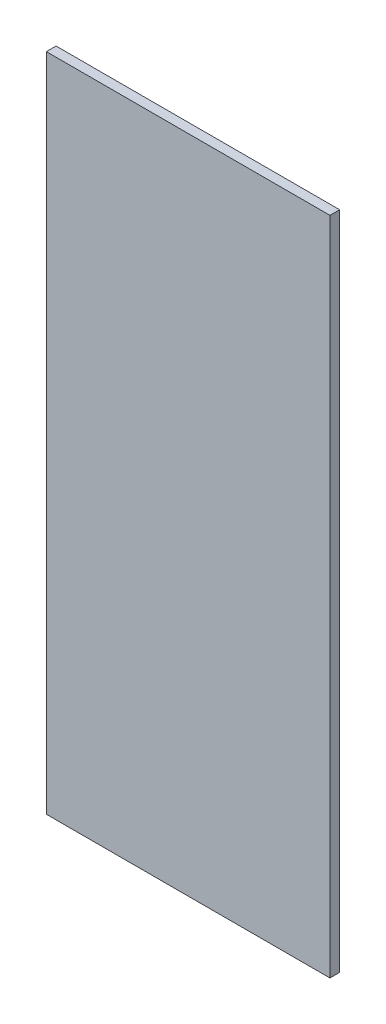
from build123d import *

# Parameters (mm, degrees)
SKETCH1_W           = 146
SKETCH1_H           = 340
BOSS_EXTRUDE1_DEPTH = 2.5


with BuildPart() as part:
    # Sketch1 → Boss-Extrude1 (new, symmetric)
    with BuildSketch(Plane.XY):
        Rectangle(SKETCH1_W, SKETCH1_H)
    extrude(amount=BOSS_EXTRUDE1_DEPTH, both=True)


solid = part.part
